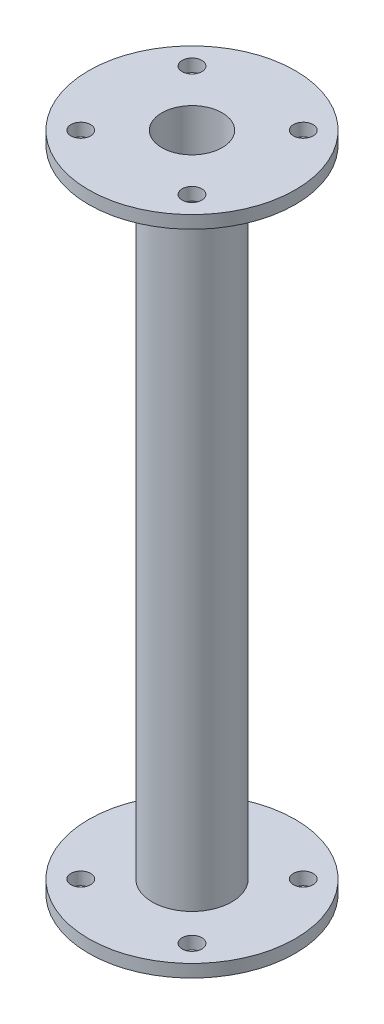
from build123d import *

# Parameters (mm, degrees)
SKETCH1_R           = 32.5
SKETCH1_R_2         = 9.5
SKETCH1_R_3         = 3.1
BOSS_EXTRUDE1_DEPTH = 4
SKETCH2_R           = 12.5
SKETCH2_R_2         = 9.5
BOSS_EXTRUDE2_DEPTH = 200
SKETCH3_R           = 32.5
SKETCH3_R_2         = 3.1
SKETCH3_R_3         = 9.5
BOSS_EXTRUDE3_DEPTH = 4


with BuildPart() as part:
    # Sketch1 → Boss-Extrude1 (new body)
    with BuildSketch(Plane(origin=(0, 0, 0), x_dir=(1, 0, 0), z_dir=(0, 1, 0))):
        with Locations(Location((0, 0, 0), (0, 0, 270))):
            Circle(SKETCH1_R)
        with Locations(Location((0, 0, 0), (0, 0, 270))):
            Circle(SKETCH1_R_2, mode=Mode.SUBTRACT)
        with Locations(Location((-17.5, 17.5, 0), (0, 0, 270))):
            Circle(SKETCH1_R_3, mode=Mode.SUBTRACT)
        with Locations(Location((17.5, 17.5, 0), (0, 0, 270))):
            Circle(SKETCH1_R_3, mode=Mode.SUBTRACT)
        with Locations(Location((17.5, -17.5, 0), (0, 0, 270))):
            Circle(SKETCH1_R_3, mode=Mode.SUBTRACT)
        with Locations(Location((-17.5, -17.5, 0), (0, 0, 270))):
            Circle(SKETCH1_R_3, mode=Mode.SUBTRACT)
    extrude(amount=BOSS_EXTRUDE1_DEPTH)

    # Sketch2 → Boss-Extrude2 (add)
    with BuildSketch(Plane(origin=(0, 4, 0), x_dir=(1, 0, 0), z_dir=(0, 1, 0))):
        with Locations(Location((0, 0, 0), (0, 0, 270))):
            Circle(SKETCH2_R)
        with Locations(Location((0, 0, 0), (0, 0, 270))):
            Circle(SKETCH2_R_2, mode=Mode.SUBTRACT)
    extrude(amount=BOSS_EXTRUDE2_DEPTH)

    # Sketch3 → Boss-Extrude3 (add)
    with BuildSketch(Plane(origin=(0, 204, 0), x_dir=(1, 0, 0), z_dir=(0, 1, 0))):
        with Locations(Location((0, 0, 0), (0, 0, 270))):
            Circle(SKETCH3_R)
        with Locations(Location((-17.5, 17.5, 0), (0, 0, 270))):
            Circle(SKETCH3_R_2, mode=Mode.SUBTRACT)
        with Locations(Location((17.5, 17.5, 0), (0, 0, 270))):
            Circle(SKETCH3_R_2, mode=Mode.SUBTRACT)
        with Locations(Location((17.5, -17.5, 0), (0, 0, 270))):
            Circle(SKETCH3_R_2, mode=Mode.SUBTRACT)
        with Locations(Location((-17.5, -17.5, 0), (0, 0, 270))):
            Circle(SKETCH3_R_2, mode=Mode.SUBTRACT)
        with Locations(Location((0, 0, 0), (0, 0, 270))):
            Circle(SKETCH3_R_3, mode=Mode.SUBTRACT)
    extrude(amount=BOSS_EXTRUDE3_DEPTH)


solid = part.part
